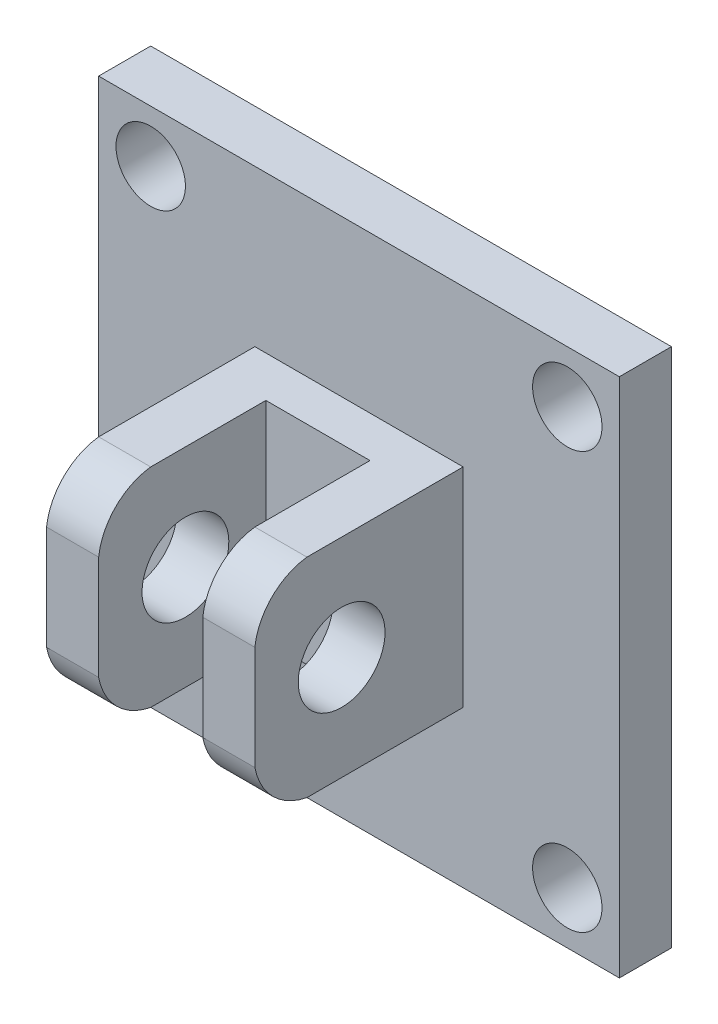
from build123d import *

# Parameters (mm, degrees)
ESQUISSE1_W             = 12
ESQUISSE1_H             = 12
BOSS_EXTRU_1_DEPTH      = 12
ESQUISSE2_W             = 6
ESQUISSE2_H             = 9.63415441
ENL_V_MAT_EXTRU_1_DEPTH = 21.784609691
ESQUISSE3_R             = 2.5
ENL_V_MAT_EXTRU_2_DEPTH = 21.784609691
ESQUISSE4_W             = 30
ESQUISSE4_H             = 30
ESQUISSE4_R             = 2
BOSS_EXTRU_2_DEPTH      = 3


with BuildPart() as part:
    # Esquisse1 → Boss.-Extru.1 (new body)
    with BuildSketch(Plane.XY):
        with Locations((6, -6)):
            Rectangle(ESQUISSE1_W, ESQUISSE1_H)
    extrude(amount=BOSS_EXTRU_1_DEPTH)

    # Esquisse2 → Enlèv. mat.-Extru.1 (cut, through all)
    with BuildSketch(Plane(origin=(0, 0, 0), x_dir=(1, 0, 0), z_dir=(0, 1, 0))):
        with Locations((6, -7.182922795)):
            Rectangle(ESQUISSE2_W, ESQUISSE2_H)
    extrude(amount=-ENL_V_MAT_EXTRU_1_DEPTH, mode=Mode.SUBTRACT)

    # Esquisse3 → Enlèv. mat.-Extru.2 (cut, through all)
    with BuildSketch(Plane.ZY):
        with Locations(Location((7, -6, 0), (0, 0, 270))):
            Circle(ESQUISSE3_R)
        with BuildLine():
            Line((12, -12), (9, -12))
            ThreePointArc((9, -12), (10.960425347, -10.960425347), (12, -9))
            Line((12, -9), (12, -12))
        make_face()
        with BuildLine():
            Line((12, 0), (12, -3))
            ThreePointArc((12, -3), (11.019761374, -0.980238626), (9, 0))
            Line((9, 0), (12, 0))
        make_face()
    extrude(amount=-ENL_V_MAT_EXTRU_2_DEPTH, mode=Mode.SUBTRACT)

    # Esquisse4 → Boss.-Extru.2 (add)
    with BuildSketch(Plane(origin=(0, 0, 0), x_dir=(-1, 0, 0), z_dir=(0, 0, -1))):
        with Locations((-6, -6)):
            Rectangle(ESQUISSE4_W, ESQUISSE4_H)
        with Locations((-18, 6)):
            Circle(ESQUISSE4_R, mode=Mode.SUBTRACT)
        with Locations((6, 6)):
            Circle(ESQUISSE4_R, mode=Mode.SUBTRACT)
        with Locations((-18, -18)):
            Circle(ESQUISSE4_R, mode=Mode.SUBTRACT)
        with Locations((6, -18)):
            Circle(ESQUISSE4_R, mode=Mode.SUBTRACT)
    extrude(amount=BOSS_EXTRU_2_DEPTH)


solid = part.part
